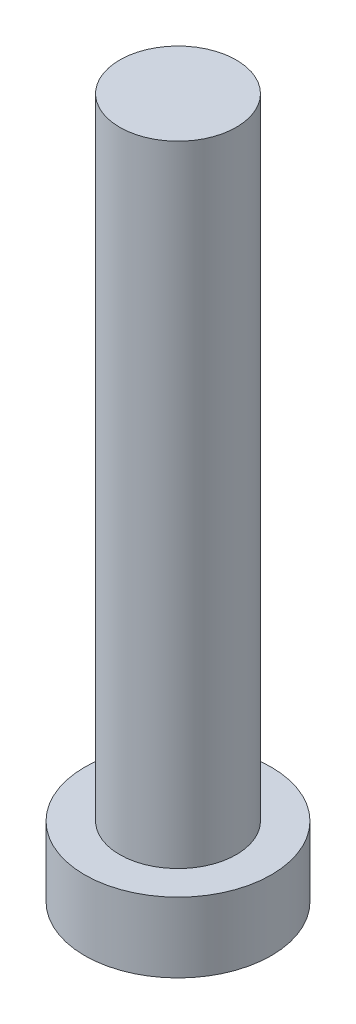
from build123d import *

# Parameters (mm, degrees)
BOSS_EXTRUDE1_DEPTH      = 3.0001
BOSS_EXTRUDE1_DEPTH_BACK = 24
SKETCH1_R                = 2.5
SKETCH2_R                = 4
BOSS_EXTRUDE2_DEPTH      = 3


with BuildPart() as part:
    # Sketch1 → Boss-Extrude1 (new, two sides: drawn at the far end of the back side and taken through both)
    with BuildSketch(Plane(origin=(0, 0, 0), x_dir=(1, 0, 0), z_dir=(0, 1, 0)).offset(-BOSS_EXTRUDE1_DEPTH_BACK)):
        with Locations(Location((0, 0, 0), (0, 0, 270))):
            Circle(SKETCH1_R)
    extrude(amount=BOSS_EXTRUDE1_DEPTH + BOSS_EXTRUDE1_DEPTH_BACK)

    # Sketch2 → Boss-Extrude2 (add)
    with BuildSketch(Plane(origin=(0, -24, 0), x_dir=(-1, 0, 0), z_dir=(0, -1, 0))):
        with Locations(Location((0, 0, 0), (0, 0, 90))):
            Circle(SKETCH2_R)
    extrude(amount=BOSS_EXTRUDE2_DEPTH)


solid = part.part
